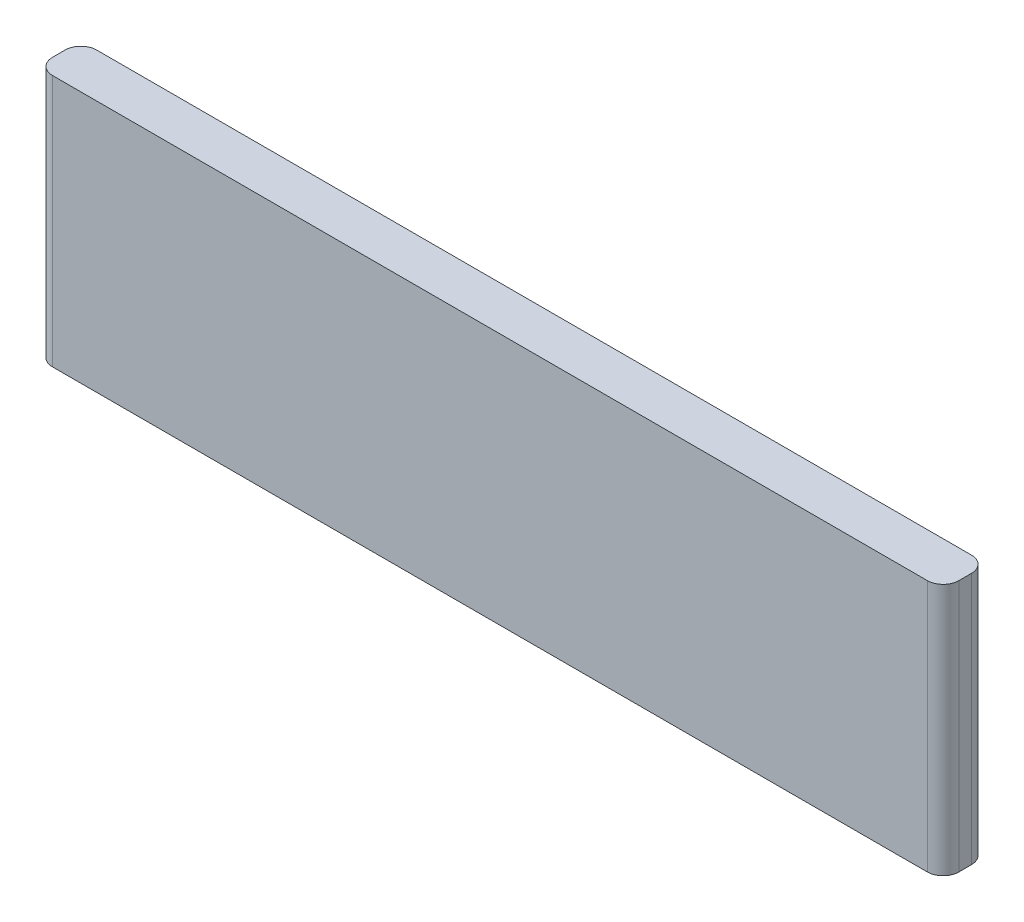
from build123d import *

# Parameters (mm, degrees)
SKETCH2_W           = 43.1
SKETCH2_H           = 2.1
BOSS_EXTRUDE1_DEPTH = 12
FILLET1_R           = 0.75


with BuildPart() as part:
    # Sketch2 → Boss-Extrude1 (new body)
    with BuildSketch(Plane(origin=(0, 0, 0), x_dir=(1, 0, 0), z_dir=(0, 1, 0))):
        Rectangle(SKETCH2_W, SKETCH2_H)
    extrude(amount=BOSS_EXTRUDE1_DEPTH)

    # Fillet1
    fillet1_edges = [part.edges().sort_by_distance(p)[0] for p in [
        (21.55, 6, 1.05),
        (-21.55, 6, 1.05),
        (-21.55, 6, -1.05),
        (21.55, 6, -1.05),
    ]]
    fillet(fillet1_edges, radius=FILLET1_R)


solid = part.part
